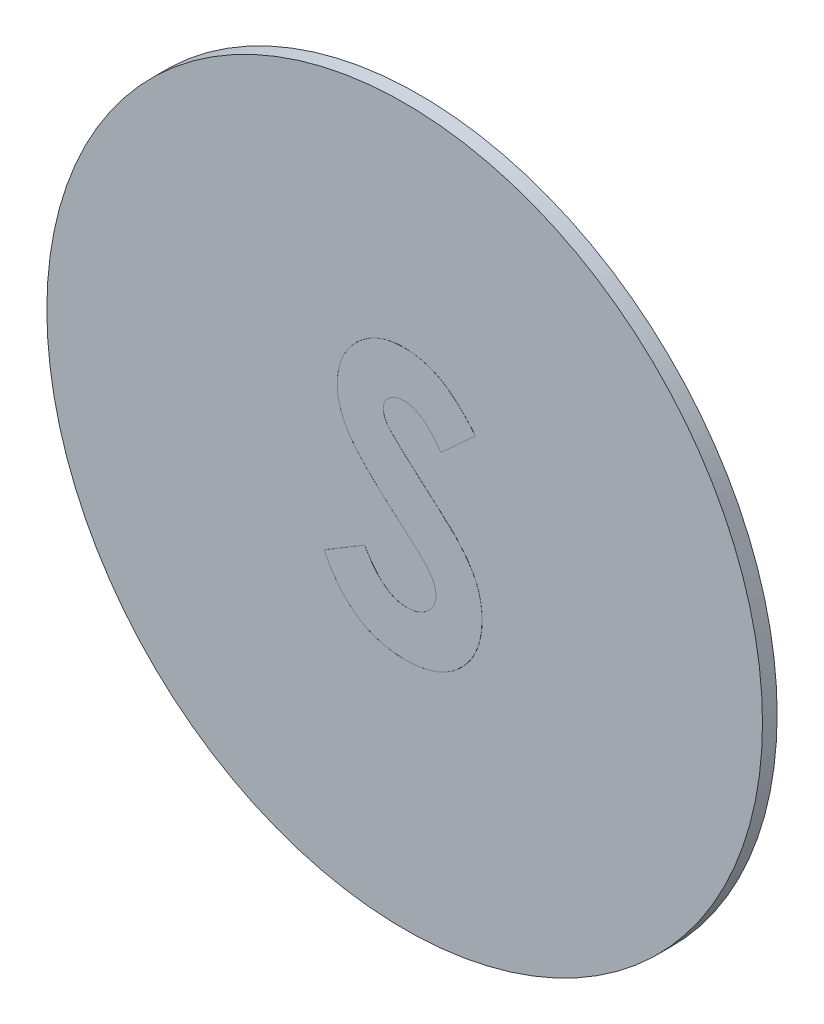
from build123d import *

# Parameters (mm, degrees)
SKETCH1_R           = 4.88
BOSS_EXTRUDE1_DEPTH = 0.2
BOSS_EXTRUDE2_DEPTH = 0.001


with BuildPart() as part:
    # Sketch1 → Boss-Extrude1 (new body)
    with BuildSketch(Plane.XY):
        with Locations((-42.086326732, 0)):
            Circle(SKETCH1_R)
    extrude(amount=BOSS_EXTRUDE1_DEPTH)

    # Sketch2 → Boss-Extrude2 (add)
    with BuildSketch(Plane.XY.offset(0.2)):
        with BuildLine():
            Line((-41.120198615, 1.43163704), (-41.589950217, 1.001849379))
            add(Edge.make_bspline(
                [(-41.589950217, 1.001849379), (-41.610072362, 1.030233756), (-41.648704073, 1.084727801), (-41.711322047, 1.157696611), (-41.773657269, 1.219944437), (-41.836287237, 1.271211235), (-41.899767079, 1.311185521), (-41.963986602, 1.339487758), (-42.02858173, 1.357479758), (-42.071979684, 1.359720195), (-42.093355666, 1.360823738)],
                knots=[0, 0, 0, 0, 1.299362458, 2.494594718, 3.587462134, 4.587049575, 5.512617175, 6.380583204, 7.202344345, 8, 8, 8, 8], degree=3))
            add(Edge.make_bspline(
                [(-42.093355666, 1.360823738), (-42.113294569, 1.360124483), (-42.151791351, 1.358774403), (-42.20667137, 1.345354714), (-42.255394633, 1.322194302), (-42.297913587, 1.291910114), (-42.331594872, 1.255424689), (-42.358486766, 1.21716086), (-42.373629162, 1.174926245), (-42.3756222, 1.145917809), (-42.376608871, 1.131556912)],
                knots=[0, 0, 0, 0, 1.185010067, 2.2879431, 3.333075148, 4.379039566, 5.372662701, 6.27520591, 7.14612461, 8, 8, 8, 8], degree=3))
            add(Edge.make_bspline(
                [(-42.376608871, 1.131556912), (-42.375990574, 1.116988924), (-42.37474541, 1.087651022), (-42.362718816, 1.044652672), (-42.344591305, 1.002638279), (-42.327269728, 0.977062118), (-42.318415762, 0.963988803)],
                knots=[0, 0, 0, 0, 0.967525499, 1.948461899, 2.951351359, 4, 4, 4, 4], degree=3))
            add(Edge.make_bspline(
                [(-42.318415762, 0.963988803), (-42.31036655, 0.953827051), (-42.291838325, 0.930436041), (-42.256508796, 0.893388326), (-42.212142327, 0.848001634), (-42.157031604, 0.795836678), (-42.093464423, 0.735017403), (-42.018494364, 0.667934638), (-41.934279393, 0.592510908), (-41.874421342, 0.539988553), (-41.843055185, 0.512466367)],
                knots=[0, 0, 0, 0, 0.473873513, 1.090794244, 1.870441696, 2.795289791, 3.865433203, 5.087734844, 6.473946851, 8, 8, 8, 8], degree=3))
            add(Edge.make_bspline(
                [(-41.843055185, 0.512466367), (-41.813613535, 0.486986103), (-41.757739399, 0.438629857), (-41.678241599, 0.369995929), (-41.608376273, 0.308247658), (-41.547125643, 0.254311753), (-41.495418209, 0.207622303), (-41.453036591, 0.167956132), (-41.419463171, 0.136085468), (-41.400378648, 0.116835568), (-41.392233871, 0.108620213)],
                knots=[0, 0, 0, 0, 1.543621617, 2.929473131, 4.163658386, 5.240097082, 6.164993805, 6.925417477, 7.541396219, 8, 8, 8, 8], degree=3))
            add(Edge.make_bspline(
                [(-41.392233871, 0.108620213), (-41.361334287, 0.075180245), (-41.301934434, 0.010896882), (-41.224735565, -0.088722113), (-41.161198399, -0.185970564), (-41.112044842, -0.28267836), (-41.074922099, -0.380240801), (-41.048750074, -0.481050601), (-41.033075474, -0.58616116), (-41.031335227, -0.657886284), (-41.030455025, -0.694164242)],
                knots=[0, 0, 0, 0, 1.206664779, 2.319633467, 3.337109185, 4.282041471, 5.190008762, 6.099243693, 7.03861361, 8, 8, 8, 8], degree=3))
            add(Edge.make_bspline(
                [(-41.030455025, -0.694164242), (-41.03108153, -0.729512664), (-41.032310757, -0.798867582), (-41.047366424, -0.900358175), (-41.068834923, -0.997489076), (-41.102028988, -1.089203366), (-41.142485717, -1.177006505), (-41.193204071, -1.2595308), (-41.252765823, -1.337611431), (-41.321032735, -1.409852611), (-41.396544047, -1.475406475), (-41.477537106, -1.533764073), (-41.564803902, -1.581945703), (-41.657598842, -1.621619839), (-41.755872254, -1.652177389), (-41.859507066, -1.674762266), (-41.968661794, -1.688317354), (-42.043303369, -1.689734377), (-42.081436596, -1.690458313)],
                knots=[0, 0, 0, 0, 1.043214005, 2.046824704, 3.02475056, 3.976699089, 4.921714032, 5.875962561, 6.831408892, 7.817874052, 8.806269674, 9.781291748, 10.760897367, 11.74438705, 12.757449933, 13.795994037, 14.874007457, 16, 16, 16, 16], degree=3))
            add(Edge.make_bspline(
                [(-42.081436596, -1.690458313), (-42.111370853, -1.689927259), (-42.170657851, -1.688875468), (-42.258037922, -1.680288472), (-42.342413259, -1.666429973), (-42.42368882, -1.646566604), (-42.502230766, -1.621397021), (-42.578042322, -1.59065334), (-42.650600136, -1.553859045), (-42.720453215, -1.511770773), (-42.787261986, -1.462900746), (-42.851871221, -1.408248094), (-42.913639159, -1.346972236), (-42.972862459, -1.279218087), (-43.029162194, -1.204793783), (-43.084381256, -1.124735821), (-43.136065543, -1.037558433), (-43.167993227, -0.97640279), (-43.184301179, -0.945165845)],
                knots=[0, 0, 0, 0, 1.016823716, 2.013894106, 2.979844003, 3.91962641, 4.853723003, 5.779685073, 6.695824784, 7.614987388, 8.547259901, 9.504950863, 10.487499108, 11.500346958, 12.559593716, 13.656357062, 14.802919212, 16, 16, 16, 16], degree=3))
            Line((-43.184301179, -0.945165845), (-42.631817205, -0.613535236))
            add(Edge.make_bspline(
                [(-42.631817205, -0.613535236), (-42.611418394, -0.64899325), (-42.572312131, -0.716969293), (-42.506042911, -0.808303722), (-42.438153479, -0.886516541), (-42.367074292, -0.950225336), (-42.293669645, -1.000281972), (-42.217584977, -1.036055918), (-42.138766834, -1.058199949), (-42.085079495, -1.060904247), (-42.058299576, -1.062253185)],
                knots=[0, 0, 0, 0, 1.283663364, 2.460892379, 3.537111102, 4.529833553, 5.449777664, 6.316464042, 7.160231139, 8, 8, 8, 8], degree=3))
            add(Edge.make_bspline(
                [(-42.058299576, -1.062253185), (-42.031060565, -1.061151569), (-41.978212917, -1.059014274), (-41.902779662, -1.039272727), (-41.833619597, -1.00827705), (-41.773838148, -0.964050493), (-41.723218986, -0.913006324), (-41.685859139, -0.856217352), (-41.662389431, -0.794773055), (-41.659908114, -0.752089805), (-41.658660153, -0.730622576)],
                knots=[0, 0, 0, 0, 1.13588714, 2.203786484, 3.234766741, 4.283437687, 5.291419208, 6.222934724, 7.106237994, 8, 8, 8, 8], degree=3))
            add(Edge.make_bspline(
                [(-41.658660153, -0.730622576), (-41.659812594, -0.710650812), (-41.662153666, -0.670080087), (-41.679397282, -0.609757943), (-41.706354313, -0.549463231), (-41.738246381, -0.500007878), (-41.770700555, -0.458600251), (-41.801734064, -0.422722416), (-41.83952467, -0.383083689), (-41.883976551, -0.339634207), (-41.934502382, -0.291991475), (-41.991144725, -0.240160157), (-42.054552194, -0.184596825), (-42.099368718, -0.146747633), (-42.122802781, -0.12695671)],
                knots=[0, 0, 0, 0, 0.916159276, 1.861089862, 2.860218735, 3.940849679, 4.552606315, 5.27541173, 6.11797699, 7.06649574, 8.129236253, 9.306560635, 10.591630461, 12, 12, 12, 12], degree=3))
            add(Edge.make_bspline(
                [(-42.122802781, -0.12695671), (-42.167351868, -0.089263911), (-42.252855049, -0.016920021), (-42.373681891, 0.089929627), (-42.482557695, 0.189790414), (-42.578542091, 0.283896837), (-42.662858071, 0.370510968), (-42.734934608, 0.450336322), (-42.79397991, 0.52398864), (-42.856112359, 0.611224883), (-42.915150608, 0.717528239), (-42.966176408, 0.845423499), (-42.999279794, 0.973302532), (-43.002988568, 1.059153471), (-43.004813999, 1.101408674)],
                knots=[0, 0, 0, 0, 1.345494975, 2.582412109, 3.71882943, 4.751509156, 5.681369928, 6.505683931, 7.230279997, 7.856715994, 8.973648664, 10.023341002, 11.027102913, 12, 12, 12, 12], degree=3))
            add(Edge.make_bspline(
                [(-43.004813999, 1.101408674), (-43.004054805, 1.131373797), (-43.00255911, 1.190408307), (-42.989217283, 1.277209952), (-42.969277414, 1.360966246), (-42.940318999, 1.441371608), (-42.902734473, 1.518325328), (-42.857089527, 1.592204125), (-42.80267538, 1.662328036), (-42.74135431, 1.728650574), (-42.67379419, 1.789261826), (-42.601597617, 1.842757329), (-42.525173229, 1.887940409), (-42.444988552, 1.925423055), (-42.360546715, 1.954113639), (-42.272469796, 1.974450955), (-42.180631467, 1.986546942), (-42.118165017, 1.988191251), (-42.086344448, 1.989028867)],
                knots=[0, 0, 0, 0, 1.010766082, 1.991317756, 2.957454644, 3.913069143, 4.869106762, 5.843196583, 6.838735724, 7.860187025, 8.887984031, 9.89767229, 10.887916223, 11.879572884, 12.879850636, 13.892031539, 14.926195476, 16, 16, 16, 16], degree=3))
            add(Edge.make_bspline(
                [(-42.086344448, 1.989028867), (-42.045106566, 1.987520297), (-41.962956318, 1.984515066), (-41.841494807, 1.961015141), (-41.722856281, 1.924059033), (-41.627255134, 1.879475555), (-41.551187086, 1.836287519), (-41.492888033, 1.796525416), (-41.433565608, 1.750975789), (-41.372741413, 1.699495101), (-41.311545656, 1.641113386), (-41.248238248, 1.577220469), (-41.183681831, 1.507264164), (-41.141730396, 1.457287704), (-41.120198615, 1.43163704)],
                knots=[0, 0, 0, 0, 1.282922637, 2.555718331, 3.837320111, 5.142675274, 5.830281639, 6.55870424, 7.337177975, 8.157850921, 9.037902056, 9.96903443, 10.957596896, 12, 12, 12, 12], degree=3))
        make_face()
    extrude(amount=BOSS_EXTRUDE2_DEPTH)


solid = part.part
